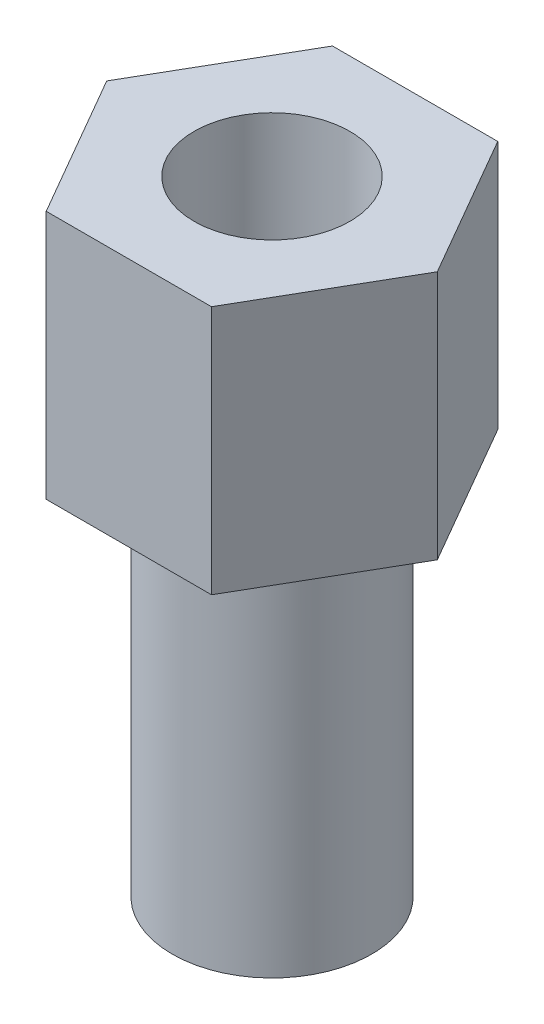
from build123d import *

# Parameters (mm, degrees)
EXTRUDE_1_DEPTH     = 4
SKETCH_6_R          = 1.6
EXTRUDE_2_DEPTH     = 6
SKETCH_7_R          = 1.25
CUT_EXTRUDE_1_DEPTH = 5


with BuildPart() as part:
    # 草图4 → 凸台-拉伸1 (new body)
    with BuildSketch(Plane(origin=(0, 0, 0), x_dir=(1, 0, 0), z_dir=(0, 1, 0))):
        Polygon((1.325, -2.29496732), (2.65, 0), (1.325, 2.29496732), (-1.325, 2.29496732), (-2.65, 0), (-1.325, -2.29496732), align=None)
    extrude(amount=EXTRUDE_1_DEPTH)

    # 草图6 → 凸台-拉伸2 (add)
    with BuildSketch(Plane(origin=(0, 0, 0), x_dir=(-1, 0, 0), z_dir=(0, -1, 0))):
        with Locations(Location((0, 0, 0), (0, 0, 270))):
            Circle(SKETCH_6_R)
    extrude(amount=EXTRUDE_2_DEPTH)

    # 草图7 → 切除-拉伸1 (cut)
    with BuildSketch(Plane(origin=(0, 4, 0), x_dir=(1, 0, 0), z_dir=(0, 1, 0))):
        with Locations(Location((0, 0, 0), (0, 0, 270))):
            Circle(SKETCH_7_R)
    extrude(amount=-CUT_EXTRUDE_1_DEPTH, mode=Mode.SUBTRACT)


solid = part.part
